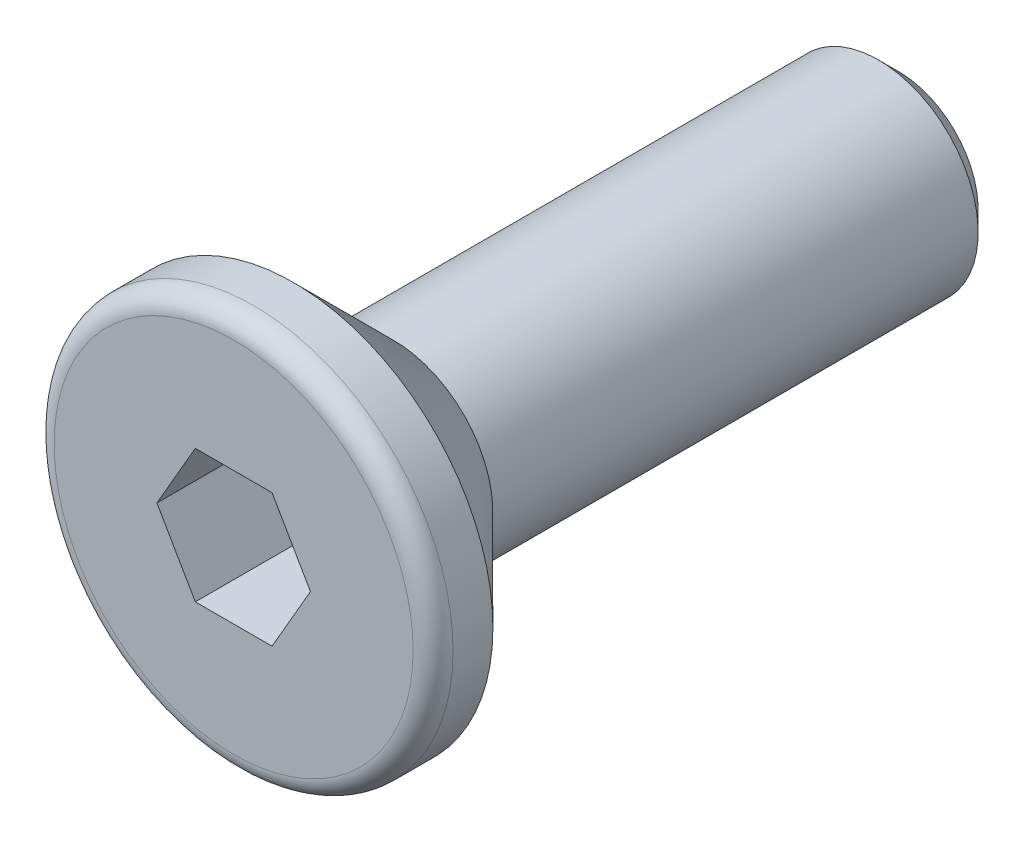
from build123d import *

# Parameters (mm, degrees)
CUT_EXTRUDE_1_DEPTH = 1.5
FILLET_1_R          = 0.3


with BuildPart() as part:
    # 草图1 → 旋转1 (revolve)
    with BuildSketch(Plane(origin=(0, 0, 0), x_dir=(0, 0, -1), z_dir=(1, 0, 0)), mode=Mode.PRIVATE) as revolve_1_sk:
        Polygon((-5, 0), (-5, 3), (-4.1, 3), (-2.6, 1.5), (4.7, 1.5), (5, 1.2), (5, 0), align=None)
    revolve(revolve_1_sk.sketch.rotate(Axis((0, 0, -5), (0, 0, 1)), 90), axis=Axis((0, 0, -5), (0, 0, 1)))

    # 草图2 → 切除-拉伸1 (cut)
    with BuildSketch(Plane.XY.offset(5)):
        Polygon((1.154700538, 0), (0.577350269, 1), (-0.577350269, 1), (-1.154700538, 0), (-0.577350269, -1), (0.577350269, -1), align=None)
    extrude(amount=-CUT_EXTRUDE_1_DEPTH, mode=Mode.SUBTRACT)

    # 圆角1
    fillet_1_edges = [part.edges().sort_by_distance(p)[0] for p in [
        (3, 0, 5),
    ]]
    fillet(fillet_1_edges, radius=FILLET_1_R)


solid = part.part
